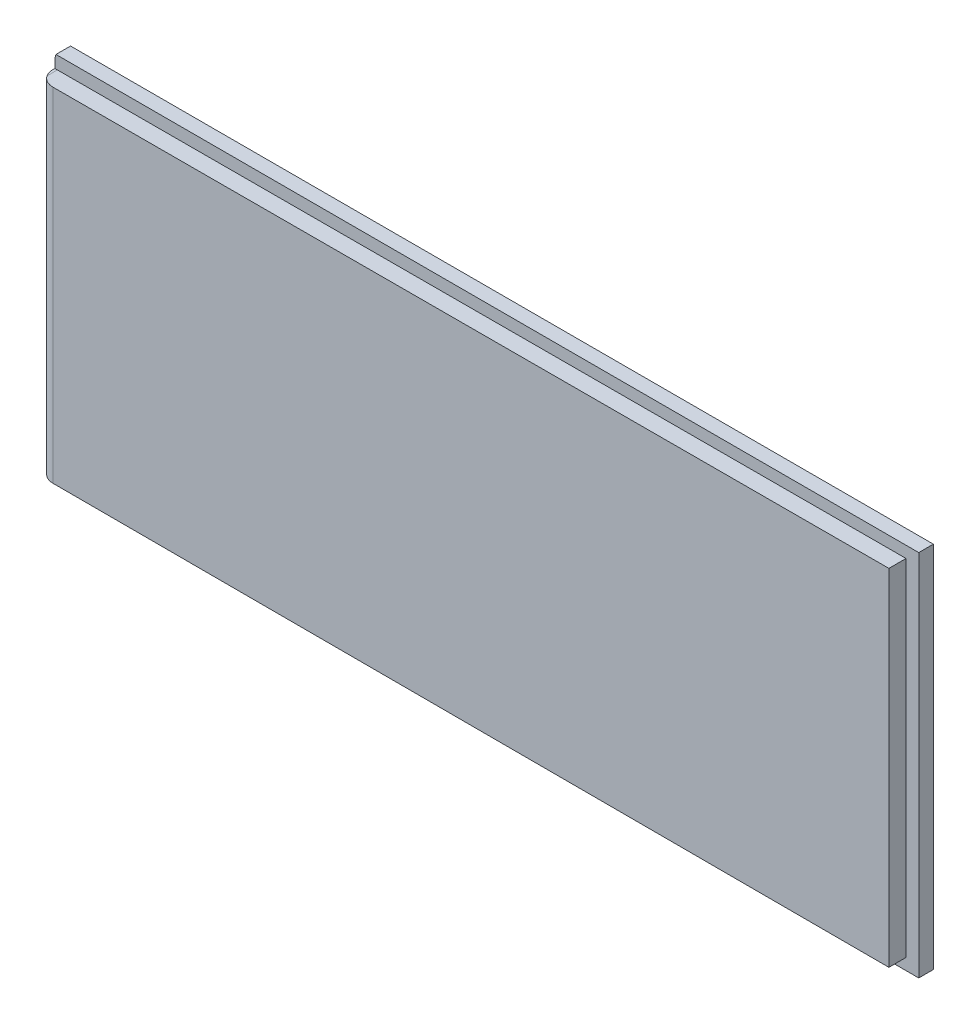
from build123d import *

# Parameters (mm, degrees)
EXTRUDE_1_DEPTH     = 1.15
CUT_EXTRUDE_1_DEPTH = 1.23
EXTRUDE_2_DEPTH     = 1.35
CUT_EXTRUDE_START   = -10
CUT_EXTRUDE_2_DEPTH = 10
CUT_EXTRUDE_3_DEPTH = 1.35
FILLET_1_R          = 1.2


with BuildPart() as part:
    # 草图1 → 凸台-拉伸1 (new body)
    with BuildSketch(Plane.XY.offset(-0.646576548)):
        with BuildLine():
            Line((-91.3, 11.1), (-91.3, -11.1))
            Line((-91.3, -11.1), (-91.3, -14))
            ThreePointArc((-91.3, -14), (-91.252485776, -14.410844989), (-91.11245155, -14.8))
            Line((-91.11245155, -14.8), (-22.7, -14.8))
            Line((-22.7, -14.8), (-22.7, 14.8))
            Line((-22.7, 14.8), (-91.11245155, 14.8))
            ThreePointArc((-91.11245155, 14.8), (-91.252485776, 14.410844989), (-91.3, 14))
            Line((-91.3, 14), (-91.3, 11.1))
        make_face()
    extrude(amount=EXTRUDE_1_DEPTH)

    # 草图2 → 切除-拉伸1 (cut)
    with BuildSketch(Plane.XY.offset(0.503423452)):
        with BuildLine():
            Line((-91.4, 14), (-91.4, -14))
            ThreePointArc((-91.4, -14), (-91.342458697, -14.464053822), (-91.173320053, -14.9))
            Line((-91.173320053, -14.9), (-22.6, -14.9))
            Line((-22.6, -14.9), (-22.6, 14.9))
            Line((-22.6, 14.9), (-91.173320053, 14.9))
            ThreePointArc((-91.173320053, 14.9), (-91.342458697, 14.464053822), (-91.4, 14))
        make_face()
        with BuildLine():
            Line((-91.2, 14), (-91.2, -14))
            ThreePointArc((-91.2, -14), (-91.161870734, -14.358030253), (-91.049193338, -14.7))
            Line((-91.049193338, -14.7), (-22.8, -14.7))
            Line((-22.8, -14.7), (-22.8, 14.7))
            Line((-22.8, 14.7), (-91.049193338, 14.7))
            ThreePointArc((-91.049193338, 14.7), (-91.161870734, 14.358030253), (-91.2, 14))
        make_face(mode=Mode.SUBTRACT)
    extrude(amount=-CUT_EXTRUDE_1_DEPTH, mode=Mode.SUBTRACT)

    # 草图4 → 凸台-拉伸2 (add)
    with BuildSketch(Plane.XY.offset(0.503423452)):
        Polygon((-91.2, 13.700440852), (-23.8, 13.799558499), (-23.8, -13.799558499), (-91.2, -13.700440852), align=None)
    extrude(amount=EXTRUDE_2_DEPTH)

    # 草图5 → 切除-拉伸2 (cut)
    with BuildSketch(Plane(origin=(0, 0, -0.646576548), x_dir=(-1, 0, 0), z_dir=(0, 0, -1)).offset(CUT_EXTRUDE_START)):
        with BuildLine():
            Line((91.049193338, 14.7), (22.8, 14.7))
            Line((22.8, 14.7), (22.8, -14.7))
            Line((22.8, -14.7), (91.049193338, -14.7))
            ThreePointArc((91.049193338, -14.7), (91.161870734, -14.358030253), (91.2, -14))
            Line((91.2, -14), (91.2, 14))
            ThreePointArc((91.2, 14), (91.161870734, 14.358030253), (91.049193338, 14.7))
        make_face()
        with BuildLine():
            Line((90.914213562, 14.5), (23, 14.5))
            Line((23, 14.5), (23, -14.5))
            Line((23, -14.5), (90.914213562, -14.5))
            ThreePointArc((90.914213562, -14.5), (90.978397839, -14.253652968), (91, -14))
            Line((91, -14), (91, 14))
            ThreePointArc((91, 14), (90.978397839, 14.253652968), (90.914213562, 14.5))
        make_face(mode=Mode.SUBTRACT)
    extrude(amount=CUT_EXTRUDE_2_DEPTH, mode=Mode.SUBTRACT)

    # 草图6 → 切除-拉伸3 (cut)
    with BuildSketch(Plane.XY.offset(1.853423452)):
        Polygon((-24, 13.599264165), (-90.8, 13.501028871), (-91, 13.501028871), (-91, 13.70073497), (-23.8, 13.799558499), (-23.8, -13.799558499), (-91, -13.70073497), (-91, -13.501028871), (-90.8, -13.501028871), (-24, -13.599264165), align=None)
    extrude(amount=-CUT_EXTRUDE_3_DEPTH, mode=Mode.SUBTRACT)

    # 圆角1
    fillet_1_edges = [part.edges().sort_by_distance(p)[0] for p in [
        (-91, 0, 1.853423452),
    ]]
    fillet(fillet_1_edges, radius=FILLET_1_R)


solid = part.part
